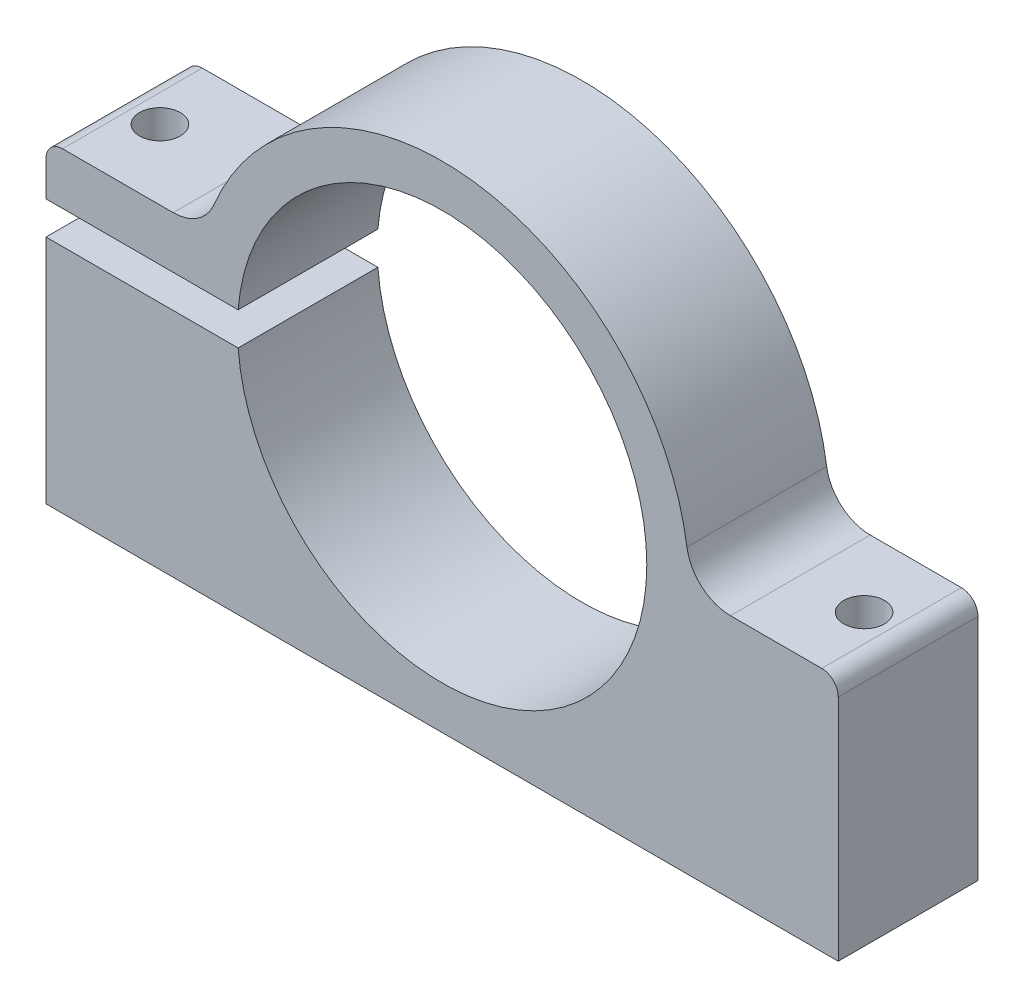
from build123d import *

# Parameters (mm, degrees)
BOSS_EXTRUDE1_DEPTH = 6.35
SKETCH2_R           = 18.6
CUT_EXTRUDE1_DEPTH  = 45.311849431
SKETCH5_R           = 1.85
CUT_EXTRUDE3_DEPTH  = 47.475934633
SKETCH6_R           = 1.85
CUT_EXTRUDE4_DEPTH  = 44.019819851
FILLET2_R           = 4
FILLET6_R           = 1.5


with BuildPart() as part:
    # Sketch1 → Boss-Extrude1 (new, symmetric)
    with BuildSketch(Plane.XY):
        with BuildLine():
            Line((0, -1.5), (-36, -1.5))
            Line((-36, -1.5), (-36, -22.5))
            Line((-36, -22.5), (36, -22.5))
            Line((36, -22.5), (36, -0.2))
            Line((36, -0.2), (22.479110303, -0.2))
            ThreePointArc((22.479110303, -0.2), (3.2294985, 22.246814141), (-21.608109589, 6.2))
            Line((-21.608109589, 6.2), (-36, 6.2))
            Line((-36, 6.2), (-36, 1.5))
            Line((-36, 1.5), (0, 1.5))
            Line((0, 1.5), (0, -1.5))
        make_face()
    extrude(amount=BOSS_EXTRUDE1_DEPTH, both=True)

    # Sketch2 → Cut-Extrude1 (cut, through all)
    with BuildSketch(Plane.XY.offset(6.35)):
        Circle(SKETCH2_R)
    extrude(amount=-CUT_EXTRUDE1_DEPTH, mode=Mode.SUBTRACT)

    # Sketch5 → Cut-Extrude3 (cut, through all)
    with BuildSketch(Plane(origin=(0, 6.2, 0), x_dir=(1, 0, 0), z_dir=(0, 1, 0))):
        with Locations(Location((-32, 0, 0), (0, 0, 180))):
            Circle(SKETCH5_R)
    extrude(amount=-CUT_EXTRUDE3_DEPTH, mode=Mode.SUBTRACT)

    # Sketch6 → Cut-Extrude4 (cut, through all)
    with BuildSketch(Plane(origin=(0, -0.2, 0), x_dir=(1, 0, 0), z_dir=(0, 1, 0))):
        with Locations(Location((32, 0, 0), (0, 0, 180))):
            Circle(SKETCH6_R)
    extrude(amount=-CUT_EXTRUDE4_DEPTH, mode=Mode.SUBTRACT)

    # Fillet2
    fillet2_edges = [part.edges().sort_by_distance(p)[0] for p in [
        (-21.608109589, 6.2, 0),
        (22.479110303, -0.2, 0),
    ]]
    fillet(fillet2_edges, radius=FILLET2_R)

    # Fillet6
    fillet6_edges = [part.edges().sort_by_distance(p)[0] for p in [
        (-36, 6.2, 0),
        (36, -0.2, 0),
    ]]
    fillet(fillet6_edges, radius=FILLET6_R)


solid = part.part
